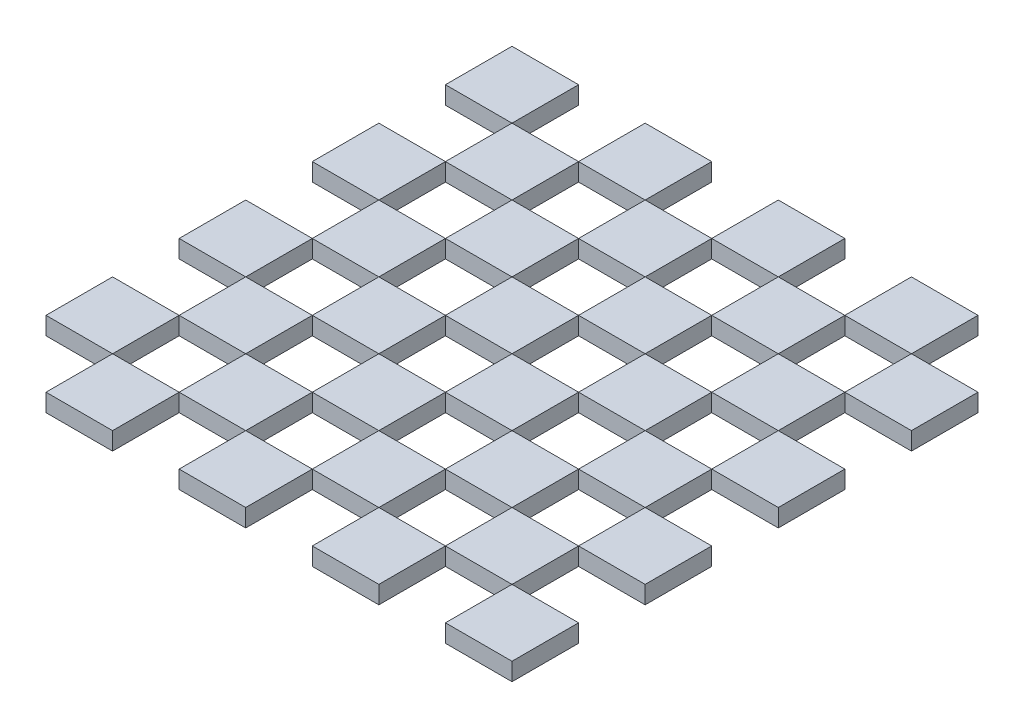
from build123d import *

# Parameters (mm, degrees)
SKETCH1_W              = 37.5
SKETCH1_H              = 37.5
BOSS_EXTRUDE1_DEPTH    = 10
BOSS_EXTRUDE1_2_DEPTH  = 10
BOSS_EXTRUDE1_3_DEPTH  = 10
BOSS_EXTRUDE1_4_DEPTH  = 10
BOSS_EXTRUDE1_5_DEPTH  = 10
BOSS_EXTRUDE1_6_DEPTH  = 10
BOSS_EXTRUDE1_7_DEPTH  = 10
BOSS_EXTRUDE1_8_DEPTH  = 10
BOSS_EXTRUDE1_9_DEPTH  = 10
BOSS_EXTRUDE1_10_DEPTH = 10
BOSS_EXTRUDE1_11_DEPTH = 10
BOSS_EXTRUDE1_12_DEPTH = 10
BOSS_EXTRUDE1_13_DEPTH = 10
BOSS_EXTRUDE1_14_DEPTH = 10
BOSS_EXTRUDE1_15_DEPTH = 10
BOSS_EXTRUDE1_16_DEPTH = 10
BOSS_EXTRUDE1_17_DEPTH = 10
BOSS_EXTRUDE1_18_DEPTH = 10
BOSS_EXTRUDE1_19_DEPTH = 10
BOSS_EXTRUDE1_20_DEPTH = 10
BOSS_EXTRUDE1_21_DEPTH = 10
BOSS_EXTRUDE1_22_DEPTH = 10
BOSS_EXTRUDE1_23_DEPTH = 10
BOSS_EXTRUDE1_24_DEPTH = 10
BOSS_EXTRUDE1_25_DEPTH = 10
BOSS_EXTRUDE1_26_DEPTH = 10
BOSS_EXTRUDE1_27_DEPTH = 10
BOSS_EXTRUDE1_28_DEPTH = 10
BOSS_EXTRUDE1_29_DEPTH = 10
BOSS_EXTRUDE1_30_DEPTH = 10
BOSS_EXTRUDE1_31_DEPTH = 10
BOSS_EXTRUDE1_32_DEPTH = 10


with BuildPart() as part:
    # Sketch1 → Boss-Extrude1 (new body)
    with BuildSketch(Plane(origin=(0, 0, 0), x_dir=(1, 0, 0), z_dir=(0, 1, 0))):
        with Locations((-131.25, 131.25)):
            Rectangle(SKETCH1_W, SKETCH1_H)
    extrude(amount=BOSS_EXTRUDE1_DEPTH)


with BuildPart() as body_2:
    # Sketch1 → Boss-Extrude1 2 (new body)
    with BuildSketch(Plane(origin=(0, 0, 0), x_dir=(1, 0, 0), z_dir=(0, 1, 0))):
        with Locations((-93.75, 93.75)):
            Rectangle(SKETCH1_W, SKETCH1_H)
    extrude(amount=BOSS_EXTRUDE1_2_DEPTH)


with BuildPart() as body_3:
    # Sketch1 → Boss-Extrude1 3 (new body)
    with BuildSketch(Plane(origin=(0, 0, 0), x_dir=(1, 0, 0), z_dir=(0, 1, 0))):
        with Locations((-131.25, 56.25)):
            Rectangle(SKETCH1_W, SKETCH1_H)
    extrude(amount=BOSS_EXTRUDE1_3_DEPTH)


with BuildPart() as body_4:
    # Sketch1 → Boss-Extrude1 4 (new body)
    with BuildSketch(Plane(origin=(0, 0, 0), x_dir=(1, 0, 0), z_dir=(0, 1, 0))):
        with Locations((-131.25, -18.75)):
            Rectangle(SKETCH1_W, SKETCH1_H)
    extrude(amount=BOSS_EXTRUDE1_4_DEPTH)


with BuildPart() as body_5:
    # Sketch1 → Boss-Extrude1 5 (new body)
    with BuildSketch(Plane(origin=(0, 0, 0), x_dir=(1, 0, 0), z_dir=(0, 1, 0))):
        with Locations((-131.25, -93.75)):
            Rectangle(SKETCH1_W, SKETCH1_H)
    extrude(amount=BOSS_EXTRUDE1_5_DEPTH)


with BuildPart() as body_6:
    # Sketch1 → Boss-Extrude1 6 (new body)
    with BuildSketch(Plane(origin=(0, 0, 0), x_dir=(1, 0, 0), z_dir=(0, 1, 0))):
        with Locations((-93.75, -131.25)):
            Rectangle(SKETCH1_W, SKETCH1_H)
    extrude(amount=BOSS_EXTRUDE1_6_DEPTH)


with BuildPart() as body_7:
    # Sketch1 → Boss-Extrude1 7 (new body)
    with BuildSketch(Plane(origin=(0, 0, 0), x_dir=(1, 0, 0), z_dir=(0, 1, 0))):
        with Locations((-93.75, -56.25)):
            Rectangle(SKETCH1_W, SKETCH1_H)
    extrude(amount=BOSS_EXTRUDE1_7_DEPTH)


with BuildPart() as body_8:
    # Sketch1 → Boss-Extrude1 8 (new body)
    with BuildSketch(Plane(origin=(0, 0, 0), x_dir=(1, 0, 0), z_dir=(0, 1, 0))):
        with Locations((-93.75, 18.75)):
            Rectangle(SKETCH1_W, SKETCH1_H)
    extrude(amount=BOSS_EXTRUDE1_8_DEPTH)


with BuildPart() as body_9:
    # Sketch1 → Boss-Extrude1 9 (new body)
    with BuildSketch(Plane(origin=(0, 0, 0), x_dir=(1, 0, 0), z_dir=(0, 1, 0))):
        with Locations((-56.25, 131.25)):
            Rectangle(SKETCH1_W, SKETCH1_H)
    extrude(amount=BOSS_EXTRUDE1_9_DEPTH)


with BuildPart() as body_10:
    # Sketch1 → Boss-Extrude1 10 (new body)
    with BuildSketch(Plane(origin=(0, 0, 0), x_dir=(1, 0, 0), z_dir=(0, 1, 0))):
        with Locations((-56.25, 56.25)):
            Rectangle(SKETCH1_W, SKETCH1_H)
    extrude(amount=BOSS_EXTRUDE1_10_DEPTH)


with BuildPart() as body_11:
    # Sketch1 → Boss-Extrude1 11 (new body)
    with BuildSketch(Plane(origin=(0, 0, 0), x_dir=(1, 0, 0), z_dir=(0, 1, 0))):
        with Locations((-56.25, -18.75)):
            Rectangle(SKETCH1_W, SKETCH1_H)
    extrude(amount=BOSS_EXTRUDE1_11_DEPTH)


with BuildPart() as body_12:
    # Sketch1 → Boss-Extrude1 12 (new body)
    with BuildSketch(Plane(origin=(0, 0, 0), x_dir=(1, 0, 0), z_dir=(0, 1, 0))):
        with Locations((-56.25, -93.75)):
            Rectangle(SKETCH1_W, SKETCH1_H)
    extrude(amount=BOSS_EXTRUDE1_12_DEPTH)


with BuildPart() as body_13:
    # Sketch1 → Boss-Extrude1 13 (new body)
    with BuildSketch(Plane(origin=(0, 0, 0), x_dir=(1, 0, 0), z_dir=(0, 1, 0))):
        with Locations((-18.75, -131.25)):
            Rectangle(SKETCH1_W, SKETCH1_H)
    extrude(amount=BOSS_EXTRUDE1_13_DEPTH)


with BuildPart() as body_14:
    # Sketch1 → Boss-Extrude1 14 (new body)
    with BuildSketch(Plane(origin=(0, 0, 0), x_dir=(1, 0, 0), z_dir=(0, 1, 0))):
        with Locations((-18.75, -56.25)):
            Rectangle(SKETCH1_W, SKETCH1_H)
    extrude(amount=BOSS_EXTRUDE1_14_DEPTH)


with BuildPart() as body_15:
    # Sketch1 → Boss-Extrude1 15 (new body)
    with BuildSketch(Plane(origin=(0, 0, 0), x_dir=(1, 0, 0), z_dir=(0, 1, 0))):
        with Locations((-18.75, 18.75)):
            Rectangle(SKETCH1_W, SKETCH1_H)
    extrude(amount=BOSS_EXTRUDE1_15_DEPTH)


with BuildPart() as body_16:
    # Sketch1 → Boss-Extrude1 16 (new body)
    with BuildSketch(Plane(origin=(0, 0, 0), x_dir=(1, 0, 0), z_dir=(0, 1, 0))):
        with Locations((-18.75, 93.75)):
            Rectangle(SKETCH1_W, SKETCH1_H)
    extrude(amount=BOSS_EXTRUDE1_16_DEPTH)


with BuildPart() as body_17:
    # Sketch1 → Boss-Extrude1 17 (new body)
    with BuildSketch(Plane(origin=(0, 0, 0), x_dir=(1, 0, 0), z_dir=(0, 1, 0))):
        with Locations((18.75, 131.25)):
            Rectangle(SKETCH1_W, SKETCH1_H)
    extrude(amount=BOSS_EXTRUDE1_17_DEPTH)


with BuildPart() as body_18:
    # Sketch1 → Boss-Extrude1 18 (new body)
    with BuildSketch(Plane(origin=(0, 0, 0), x_dir=(1, 0, 0), z_dir=(0, 1, 0))):
        with Locations((18.75, 56.25)):
            Rectangle(SKETCH1_W, SKETCH1_H)
    extrude(amount=BOSS_EXTRUDE1_18_DEPTH)


with BuildPart() as body_19:
    # Sketch1 → Boss-Extrude1 19 (new body)
    with BuildSketch(Plane(origin=(0, 0, 0), x_dir=(1, 0, 0), z_dir=(0, 1, 0))):
        with Locations((18.75, -18.75)):
            Rectangle(SKETCH1_W, SKETCH1_H)
    extrude(amount=BOSS_EXTRUDE1_19_DEPTH)


with BuildPart() as body_20:
    # Sketch1 → Boss-Extrude1 20 (new body)
    with BuildSketch(Plane(origin=(0, 0, 0), x_dir=(1, 0, 0), z_dir=(0, 1, 0))):
        with Locations((18.75, -93.75)):
            Rectangle(SKETCH1_W, SKETCH1_H)
    extrude(amount=BOSS_EXTRUDE1_20_DEPTH)


with BuildPart() as body_21:
    # Sketch1 → Boss-Extrude1 21 (new body)
    with BuildSketch(Plane(origin=(0, 0, 0), x_dir=(1, 0, 0), z_dir=(0, 1, 0))):
        with Locations((56.25, -131.25)):
            Rectangle(SKETCH1_W, SKETCH1_H)
    extrude(amount=BOSS_EXTRUDE1_21_DEPTH)


with BuildPart() as body_22:
    # Sketch1 → Boss-Extrude1 22 (new body)
    with BuildSketch(Plane(origin=(0, 0, 0), x_dir=(1, 0, 0), z_dir=(0, 1, 0))):
        with Locations((56.25, -56.25)):
            Rectangle(SKETCH1_W, SKETCH1_H)
    extrude(amount=BOSS_EXTRUDE1_22_DEPTH)


with BuildPart() as body_23:
    # Sketch1 → Boss-Extrude1 23 (new body)
    with BuildSketch(Plane(origin=(0, 0, 0), x_dir=(1, 0, 0), z_dir=(0, 1, 0))):
        with Locations((56.25, 18.75)):
            Rectangle(SKETCH1_W, SKETCH1_H)
    extrude(amount=BOSS_EXTRUDE1_23_DEPTH)


with BuildPart() as body_24:
    # Sketch1 → Boss-Extrude1 24 (new body)
    with BuildSketch(Plane(origin=(0, 0, 0), x_dir=(1, 0, 0), z_dir=(0, 1, 0))):
        with Locations((56.25, 93.75)):
            Rectangle(SKETCH1_W, SKETCH1_H)
    extrude(amount=BOSS_EXTRUDE1_24_DEPTH)


with BuildPart() as body_25:
    # Sketch1 → Boss-Extrude1 25 (new body)
    with BuildSketch(Plane(origin=(0, 0, 0), x_dir=(1, 0, 0), z_dir=(0, 1, 0))):
        with Locations((93.75, 131.25)):
            Rectangle(SKETCH1_W, SKETCH1_H)
    extrude(amount=BOSS_EXTRUDE1_25_DEPTH)


with BuildPart() as body_26:
    # Sketch1 → Boss-Extrude1 26 (new body)
    with BuildSketch(Plane(origin=(0, 0, 0), x_dir=(1, 0, 0), z_dir=(0, 1, 0))):
        with Locations((93.75, 56.25)):
            Rectangle(SKETCH1_W, SKETCH1_H)
    extrude(amount=BOSS_EXTRUDE1_26_DEPTH)


with BuildPart() as body_27:
    # Sketch1 → Boss-Extrude1 27 (new body)
    with BuildSketch(Plane(origin=(0, 0, 0), x_dir=(1, 0, 0), z_dir=(0, 1, 0))):
        with Locations((93.75, -18.75)):
            Rectangle(SKETCH1_W, SKETCH1_H)
    extrude(amount=BOSS_EXTRUDE1_27_DEPTH)


with BuildPart() as body_28:
    # Sketch1 → Boss-Extrude1 28 (new body)
    with BuildSketch(Plane(origin=(0, 0, 0), x_dir=(1, 0, 0), z_dir=(0, 1, 0))):
        with Locations((93.75, -93.75)):
            Rectangle(SKETCH1_W, SKETCH1_H)
    extrude(amount=BOSS_EXTRUDE1_28_DEPTH)


with BuildPart() as body_29:
    # Sketch1 → Boss-Extrude1 29 (new body)
    with BuildSketch(Plane(origin=(0, 0, 0), x_dir=(1, 0, 0), z_dir=(0, 1, 0))):
        with Locations((131.25, -131.25)):
            Rectangle(SKETCH1_W, SKETCH1_H)
    extrude(amount=BOSS_EXTRUDE1_29_DEPTH)


with BuildPart() as body_30:
    # Sketch1 → Boss-Extrude1 30 (new body)
    with BuildSketch(Plane(origin=(0, 0, 0), x_dir=(1, 0, 0), z_dir=(0, 1, 0))):
        with Locations((131.25, -56.25)):
            Rectangle(SKETCH1_W, SKETCH1_H)
    extrude(amount=BOSS_EXTRUDE1_30_DEPTH)


with BuildPart() as body_31:
    # Sketch1 → Boss-Extrude1 31 (new body)
    with BuildSketch(Plane(origin=(0, 0, 0), x_dir=(1, 0, 0), z_dir=(0, 1, 0))):
        with Locations((131.25, 18.75)):
            Rectangle(SKETCH1_W, SKETCH1_H)
    extrude(amount=BOSS_EXTRUDE1_31_DEPTH)


with BuildPart() as body_32:
    # Sketch1 → Boss-Extrude1 32 (new body)
    with BuildSketch(Plane(origin=(0, 0, 0), x_dir=(1, 0, 0), z_dir=(0, 1, 0))):
        with Locations((131.25, 93.75)):
            Rectangle(SKETCH1_W, SKETCH1_H)
    extrude(amount=BOSS_EXTRUDE1_32_DEPTH)


solid = Compound([part.part, body_2.part, body_3.part, body_4.part, body_5.part, body_6.part, body_7.part, body_8.part, body_9.part, body_10.part, body_11.part, body_12.part, body_13.part, body_14.part, body_15.part, body_16.part, body_17.part, body_18.part, body_19.part, body_20.part, body_21.part, body_22.part, body_23.part, body_24.part, body_25.part, body_26.part, body_27.part, body_28.part, body_29.part, body_30.part, body_31.part, body_32.part])
